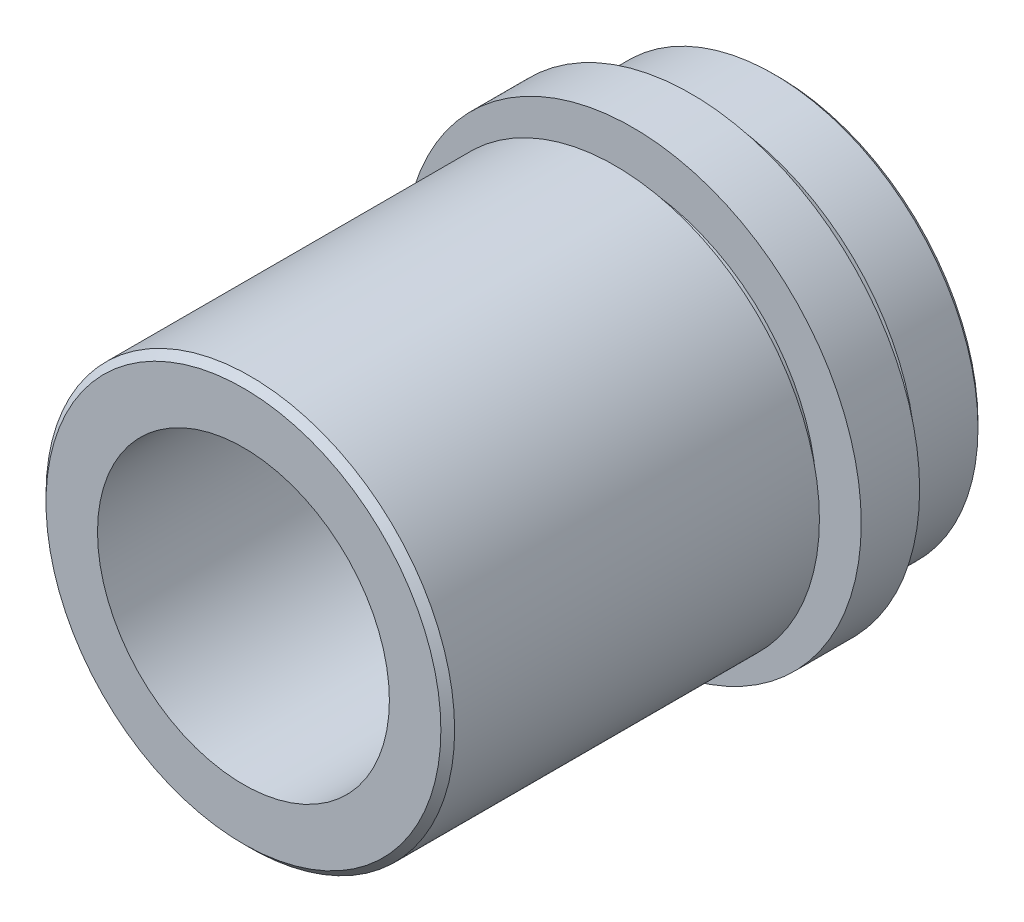
from build123d import *

# Parameters (mm, degrees)
SZKIC1_W = 6
SZKIC1_H = 23.5
SZKIC2_W = 40
SZKIC2_H = 21
SZKIC4_W = 1.8
SZKIC4_H = 2.1
SZKIC5_W = 9
SZKIC5_H = 21
SZKIC8_W = 2.1
SZKIC8_H = 2.1


with BuildPart() as part:
    # Szkic1 → Obrót1 (revolve)
    with BuildSketch(Plane(origin=(0, 0, 0), x_dir=(0, 0, -1), z_dir=(1, 0, 0))):
        with Locations((-12, 11.75)):
            Rectangle(SZKIC1_W, SZKIC1_H)
    revolve(axis=Axis((0, 0, 9), (0, 0, 1)))

    # Szkic2 → Obrót2 (revolve)
    with BuildSketch(Plane(origin=(0, 0, 0), x_dir=(0, 0, -1), z_dir=(1, 0, 0))):
        with Locations((-35, 10.5)):
            Rectangle(SZKIC2_W, SZKIC2_H)
    revolve(axis=Axis((0, 0, 15), (0, 0, 1)))

    # Szkic3 → Wycięcie-obrót1 (revolve, cut)
    with BuildSketch(Plane(origin=(0, 0, 0), x_dir=(0, 0, -1), z_dir=(1, 0, 0))):
        Polygon((-55, 20.292893219), (-54.292893219, 21), (-55, 21), align=None)
    revolve(axis=Axis((0, 0, 15), (0, 0, 1)), mode=Mode.SUBTRACT)

    # Szkic4 → Wycięcie-obrót2 (revolve, cut)
    with BuildSketch(Plane(origin=(0, 0, 0), x_dir=(0, 0, -1), z_dir=(1, 0, 0))):
        with Locations((-15.9, 19.95)):
            Rectangle(SZKIC4_W, SZKIC4_H)
    revolve(axis=Axis((0, 0, 15), (0, 0, 1)), mode=Mode.SUBTRACT)

    # Szkic5 → Obrót3 (revolve)
    with BuildSketch(Plane(origin=(0, 0, 0), x_dir=(0, 0, -1), z_dir=(1, 0, 0))):
        with Locations((-4.5, 10.5)):
            Rectangle(SZKIC5_W, SZKIC5_H)
    revolve(axis=Axis((0, 0, 0), (0, 0, 1)))

    # Szkic6 → Wycięcie-obrót3 (revolve, cut)
    with BuildSketch(Plane(origin=(0, 0, 0), x_dir=(0, 0, -1), z_dir=(1, 0, 0))):
        Polygon((-55, 0), (-55, 15), (-1, 15), (0, 16), (0, 0), align=None)
    revolve(axis=Axis((0, 0, 0), (0, 0, 1)), mode=Mode.SUBTRACT)

    # Szkic7 → Wycięcie-obrót4 (revolve, cut)
    with BuildSketch(Plane(origin=(0, 0, 0), x_dir=(0, 0, -1), z_dir=(1, 0, 0))):
        Polygon((-0.5, 21), (0, 20.5), (0, 21), align=None)
    revolve(axis=Axis((0, 0, 0), (0, 0, 1)), mode=Mode.SUBTRACT)

    # Szkic8 → Wycięcie-obrót5 (revolve, cut)
    with BuildSketch(Plane(origin=(0, 0, 0), x_dir=(0, 0, -1), z_dir=(1, 0, 0))):
        with Locations((-7.95, 19.95)):
            Rectangle(SZKIC8_W, SZKIC8_H)
    revolve(axis=Axis((0, 0, 0), (0, 0, 1)), mode=Mode.SUBTRACT)


solid = part.part
